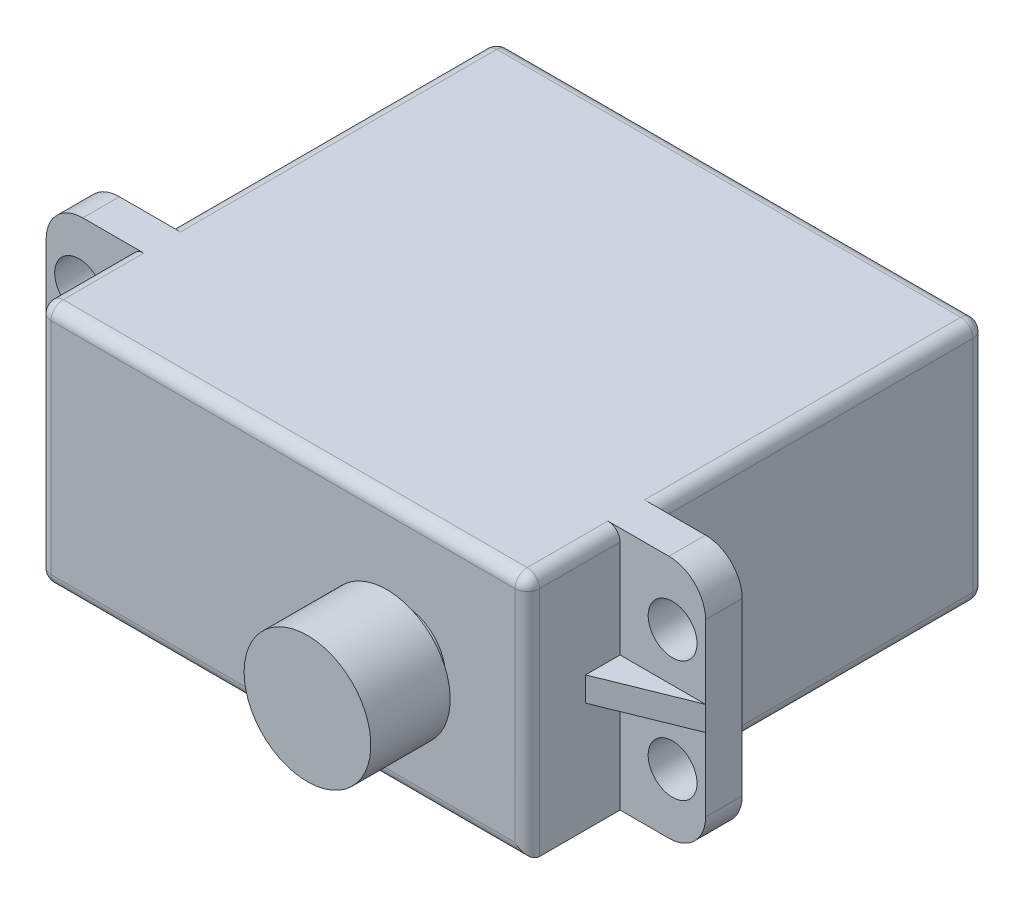
from build123d import *

# Parameters (mm, degrees)
BOSS_EXTRUDE1_DEPTH      = 10.6
BOSS_EXTRUDE1_DEPTH_BACK = 26.9
SKETCH1_W                = 40
SKETCH1_H                = 20
SKETCH1_3_W              = 40
SKETCH1_3_H              = 20
SKETCH1_3_W_2            = 7
SKETCH1_3_R              = 2
BOSS_EXTRUDE2_DEPTH      = 3
SKETCH2_R                = 3.307057182
BOSS_EXTRUDE3_DEPTH      = 1.5
BOSS_EXTRUDE4_START      = 1.5
SKETCH2_3_R              = 5.189986332
SKETCH2_3_R_2            = 3.307057182
BOSS_EXTRUDE4_DEPTH      = 6.5
FILLET1_R                = 3
FILLET2_R                = 1
BOSS_EXTRUDE6_DEPTH      = 1


with BuildPart() as part:
    # Sketch1 → Boss-Extrude1 (new, two sides: drawn at the far end of the back side and taken through both)
    with BuildSketch(Plane.XY.offset(-BOSS_EXTRUDE1_DEPTH_BACK)):
        Rectangle(SKETCH1_W, SKETCH1_H)
    extrude(amount=BOSS_EXTRUDE1_DEPTH + BOSS_EXTRUDE1_DEPTH_BACK)

    # Sketch1<3> → Boss-Extrude2 (add)
    # profile 1 of 3: a face of its own
    with BuildSketch(Plane.XY):
        Rectangle(SKETCH1_3_W, SKETCH1_3_H)
    # profile 2 of 3: a face of its own
    with BuildSketch(Plane.XY):
        with Locations((-23.5, 0)):
            Rectangle(SKETCH1_3_W_2, SKETCH1_3_H)
        with Locations((-24.3, -4.95)):
            Circle(SKETCH1_3_R, mode=Mode.SUBTRACT)
        with Locations((-24.3, 4.95)):
            Circle(SKETCH1_3_R, mode=Mode.SUBTRACT)
    # profile 3 of 3: a face of its own
    with BuildSketch(Plane.XY):
        with Locations((23.5, 0)):
            Rectangle(SKETCH1_3_W_2, SKETCH1_3_H)
        with Locations((24.3, -4.95)):
            Circle(SKETCH1_3_R, mode=Mode.SUBTRACT)
        with Locations((24.3, 4.95)):
            Circle(SKETCH1_3_R, mode=Mode.SUBTRACT)
    extrude(amount=BOSS_EXTRUDE2_DEPTH)

    # Sketch2 → Boss-Extrude3 (add)
    with BuildSketch(Plane.XY.offset(10.6)):
        with Locations((10, 0)):
            Circle(SKETCH2_R)
    extrude(amount=BOSS_EXTRUDE3_DEPTH)

    # Sketch2<3> → Boss-Extrude4 (add)
    # profile 1 of 2: a face of its own
    with BuildSketch(Plane.XY.offset(10.6).offset(BOSS_EXTRUDE4_START)):
        with Locations(Location((10, 0, 0), (0, 0, 180))):
            Circle(SKETCH2_3_R)
        with Locations((10, 0)):
            Circle(SKETCH2_3_R_2, mode=Mode.SUBTRACT)
    # profile 2 of 2: a face of its own
    with BuildSketch(Plane.XY.offset(10.6).offset(BOSS_EXTRUDE4_START)):
        with Locations((10, 0)):
            Circle(SKETCH2_3_R_2)
    extrude(amount=BOSS_EXTRUDE4_DEPTH)

    # Fillet1
    fillet1_edges = [part.edges().sort_by_distance(p)[0] for p in [
        (-27, 10, 1.5),
        (-27, -10, 1.5),
        (27, -10, 1.5),
        (27, 10, 1.5),
    ]]
    fillet(fillet1_edges, radius=FILLET1_R)

    # Fillet2
    fillet2_edges = [part.edges().sort_by_distance(p)[0] for p in [
        (20, 0, -26.9),
        (0, 10, 10.6),
        (-20, 0, 10.6),
        (0, -10, 10.6),
        (20, 0, 10.6),
        (0, 10, -26.9),
        (-20, 0, -26.9),
        (-20, -10, 6.8),
        (-20, 10, 6.8),
        (20, 10, 6.8),
        (0, -10, -26.9),
        (-20, -10, -13.45),
        (-20, 10, -13.45),
        (20, 10, -13.45),
        (20, -10, -13.45),
    ]]
    fillet(fillet2_edges, radius=FILLET2_R)

    # Sketch4 → Boss-Extrude6 (add, symmetric)
    with BuildSketch(Plane(origin=(0, 0, 0), x_dir=(1, 0, 0), z_dir=(0, 1, 0))):
        Polygon((-27, -3), (-20, -5.826634937), (-20, -3), align=None)
    boss_extrude6 = extrude(amount=BOSS_EXTRUDE6_DEPTH, both=True)

    # Mirror1: Boss-Extrude6 across plane
    add(boss_extrude6.mirror(Plane(origin=(0, 0, 0), x_dir=(0, 0, 1), z_dir=(1, 0, 0))))


solid = part.part
